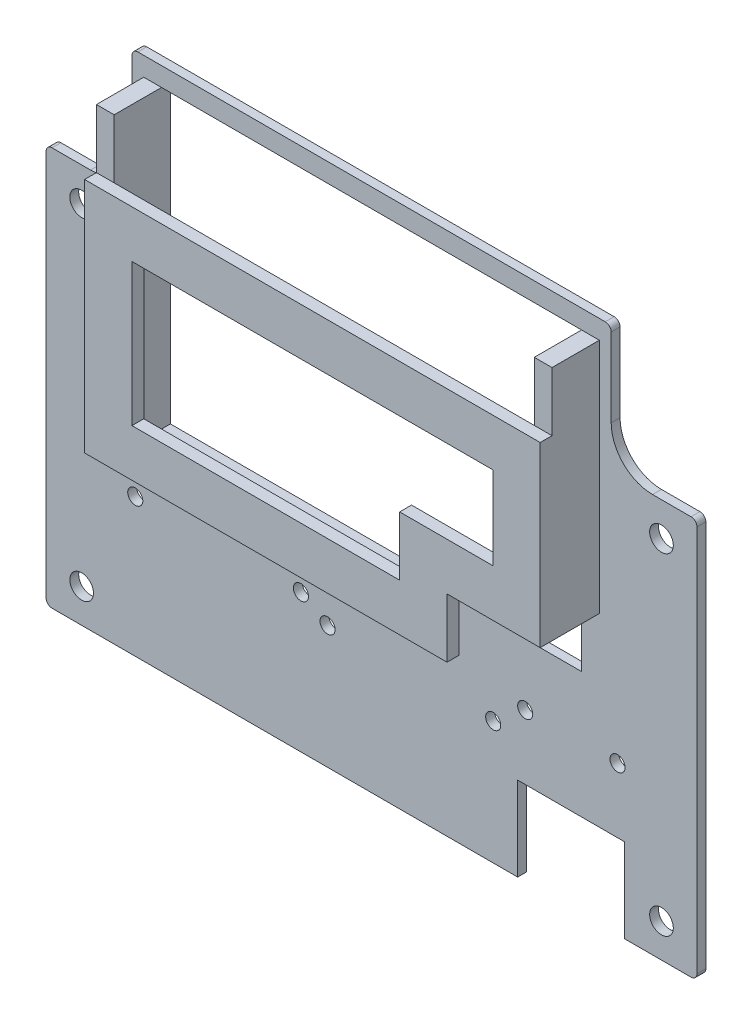
from build123d import *

# Parameters (mm, degrees)
SKETCH_1_R           = 2
EXTRUDE_1_DEPTH      = 1.5
SKETCH_2_W           = 3
SKETCH_2_H           = 50
SKETCH_2_H_2         = 40
EXTRUDE_3_DEPTH      = 8
EXTRUDE_4_DEPTH      = 2
SKETCH_4_W           = 71.000000198
SKETCH_4_H           = 50
CUT_EXTRUDE_1_DEPTH  = 128.300477144
CUT_EXTRUDE_3_DEPTH  = 128.427082997
HOLE_WIZARD_M2_5_1_D = 2.55
SKETCH_11_W          = 18.075
SKETCH_11_H          = 14.197672296
CUT_EXTRUDE_4_DEPTH  = 128.300477144


with BuildPart() as part:
    # 草圖1 → 填料-伸長1 (new body)
    with BuildSketch(Plane.XY):
        with BuildLine():
            Line((-78.58357781, -93.341907955), (16.519190028, -93.341907955))
            Line((16.519190028, -93.341907955), (23.019189929, -93.341907955))
            ThreePointArc((23.019189929, -93.341907955), (23.72629671, -93.049014736), (24.019189929, -92.341907955))
            Line((24.019189929, -92.341907955), (24.019189929, -26.916101175))
            ThreePointArc((24.019189929, -26.916101175), (23.715868617, -26.228364762), (23.019189929, -25.946187519))
            Line((23.019189929, -25.946187519), (16.519190028, -25.946187519))
            ThreePointArc((16.519190028, -25.946187519), (11.569442559, -23.895934988), (9.519190028, -18.946187519))
            Line((9.519190028, -18.946187519), (9.519190028, -5.659090909))
            ThreePointArc((9.519190028, -5.659090909), (9.226296809, -4.951984128), (8.519190028, -4.659090909))
            Line((8.519190028, -4.659090909), (-70.48081017, -4.659090909))
            ThreePointArc((-70.48081017, -4.659090909), (-71.187916951, -4.951984128), (-71.48081017, -5.659090909))
            Line((-71.48081017, -5.659090909), (-71.48081017, -18.946187519))
            ThreePointArc((-71.48081017, -18.946187519), (-73.531062702, -23.895934988), (-78.48081017, -25.946187519))
            Line((-78.48081017, -25.946187519), (-84.980810071, -25.946187519))
            ThreePointArc((-84.980810071, -25.946187519), (-85.687916853, -26.239080738), (-85.980810071, -26.946187519))
            Line((-85.980810071, -26.946187519), (-85.980810071, -92.341911374))
            ThreePointArc((-85.980810071, -92.341911374), (-85.688840793, -93.048093006), (-84.983425077, -93.341907955))
            Line((-84.983425077, -93.341907955), (-78.58357781, -93.341907955))
        make_face()
        with Locations((-79.980810071, -31.644049447)):
            Circle(SKETCH_1_R, mode=Mode.SUBTRACT)
        with Locations((18.019189929, -31.644049447)):
            Circle(SKETCH_1_R, mode=Mode.SUBTRACT)
        with Locations((18.019189929, -87.644049447)):
            Circle(SKETCH_1_R, mode=Mode.SUBTRACT)
        with Locations((-79.980810071, -87.644049447)):
            Circle(SKETCH_1_R, mode=Mode.SUBTRACT)
    extrude(amount=EXTRUDE_1_DEPTH)

    # 草圖2 → 填料-伸長3 (add)
    with BuildSketch(Plane.XY.offset(1.5)):
        with Locations((-67.98081017, -32.85713984)):
            Rectangle(SKETCH_2_W, SKETCH_2_H)
        with Locations((6.019190028, -27.85713984)):
            Rectangle(SKETCH_2_W, SKETCH_2_H_2)
    extrude(amount=EXTRUDE_3_DEPTH)

    # 草圖3 → 填料-伸長4 (add)
    with BuildSketch(Plane.XY.offset(9.5)):
        Polygon((-69.48081017, -17.828011501), (7.519190028, -17.828011501), (7.519190028, -47.85713984), (-8.225095928, -47.85713984), (-8.225095928, -57.85713984), (-69.48081017, -57.85713984), align=None)
    extrude(amount=EXTRUDE_4_DEPTH)

    # 草圖4 → 除料-伸長1 (cut, through all)
    with BuildSketch(Plane.XY.offset(1.5)):
        with Locations((-30.980810071, -32.85713984)):
            Rectangle(SKETCH_4_W, SKETCH_4_H)
    extrude(amount=-CUT_EXTRUDE_1_DEPTH, mode=Mode.SUBTRACT)

    # 草圖7 → 除料-伸長3 (cut, through all)
    with BuildSketch(Plane.XY.offset(11.5)):
        Polygon((-16.225095928, -49.85713984), (-16.225095928, -39.85713984), (-0.480809972, -39.85713984), (-0.480809972, -25.828011501), (-61.48081017, -25.828011501), (-61.48081017, -49.85713984), align=None)
    extrude(amount=-CUT_EXTRUDE_3_DEPTH, mode=Mode.SUBTRACT)

    # M2.5 螺旋的螺孔鑽1 (through all)
    with Locations(Plane.XY.offset(1.5)):
        with Locations((10.589404461, -68.244235659), (-5.010595539, -68.244235659), (-10.419668394, -72.571170345), (-38.419668394, -72.571170345), (-42.919668394, -69.961668418), (-70.919668394, -69.961668418)):
            Hole(HOLE_WIZARD_M2_5_1_D / 2)

    # 草圖11 → 除料-伸長4 (cut, through all)
    with BuildSketch(Plane.XY.offset(1.5)):
        with Locations((2.751904461, -86.243071807)):
            Rectangle(SKETCH_11_W, SKETCH_11_H)
    extrude(amount=-CUT_EXTRUDE_4_DEPTH, mode=Mode.SUBTRACT)


solid = part.part
